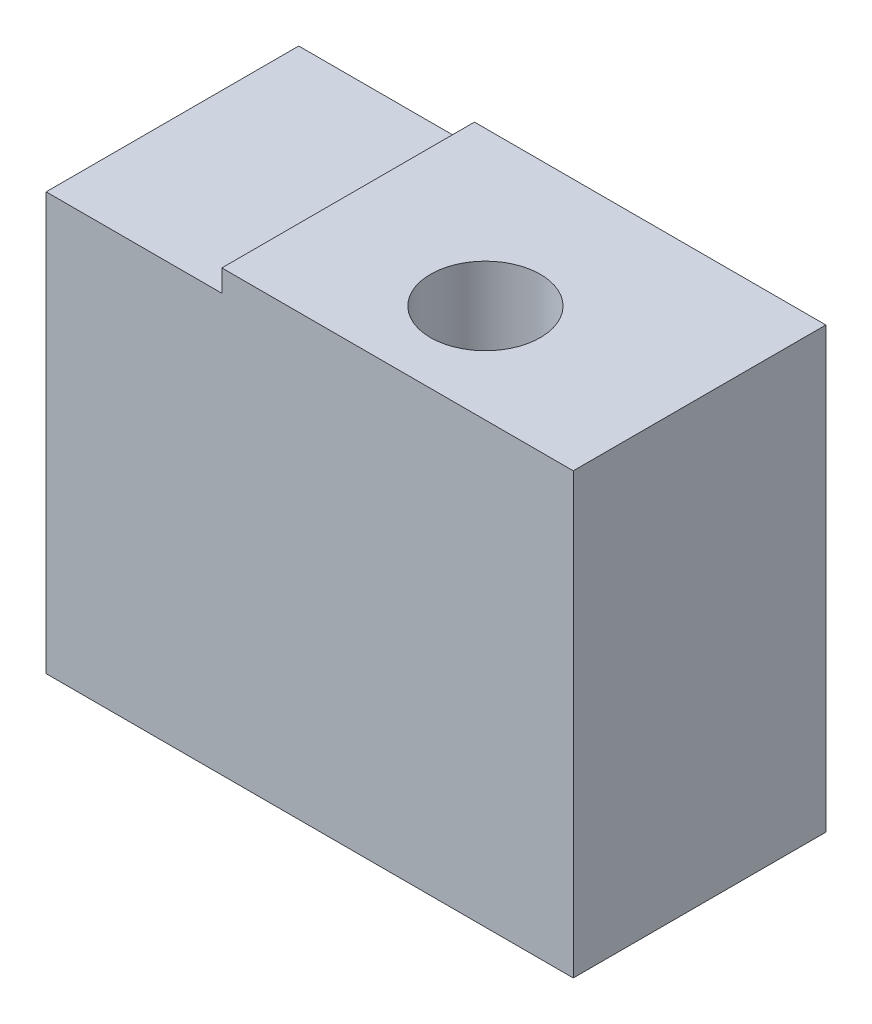
from build123d import *

# Parameters (mm, degrees)
BOSS_EXTRUDE1_DEPTH   = 11.5
M6X1_0_TAPPED_HOLE1_D = 5


with BuildPart() as part:
    # Sketch1 → Boss-Extrude1 (new body)
    with BuildSketch(Plane.XY):
        Polygon((0, 0), (24, 0), (24, 20), (8, 20), (8, 19), (0, 19), align=None)
    extrude(amount=BOSS_EXTRUDE1_DEPTH)

    # M6x1.0 Tapped Hole1 (through all)
    with Locations(Plane(origin=(0, 20, 0), x_dir=(1, 0, 0), z_dir=(0, 1, 0))):
        with Locations((15.5, -7)):
            Hole(M6X1_0_TAPPED_HOLE1_D / 2)


solid = part.part
